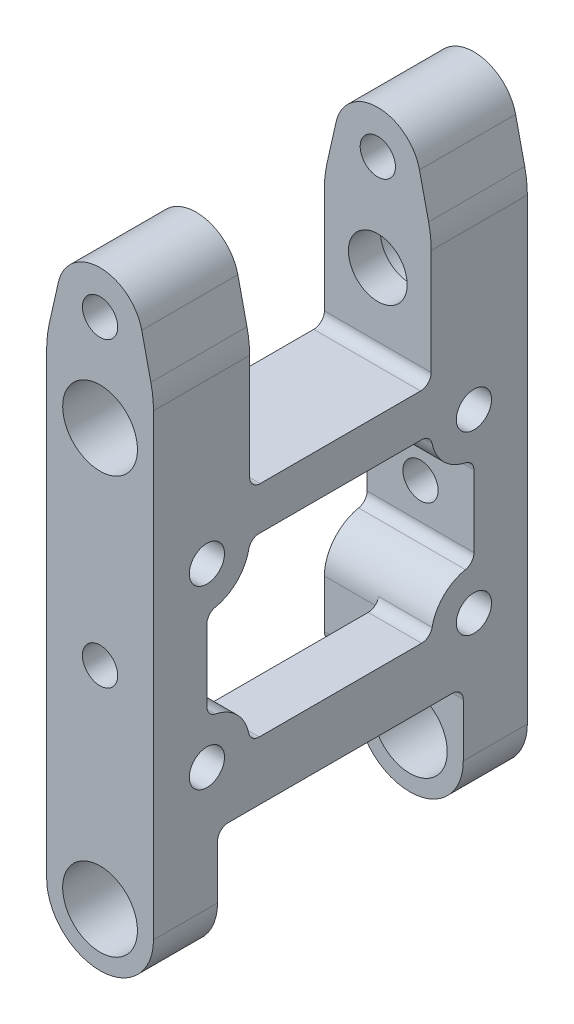
from build123d import *

# Parameters (mm, degrees)
SKETCH_2_R          = 2.750000000000002
SKETCH_2_R_2        = 2.7500000000000018
EXTRUDE_1_DEPTH     = 17.5
SKETCH_8_W          = 23
SKETCH_8_H          = 10.999999999999996
SKETCH_8_W_2        = 17
SKETCH_8_H_2        = 19.999999999999993
CUT_EXTRUDE_2_DEPTH = 56.76961538328914
SKETCH_3_R          = 3.5000000000000004
SKETCH_3_R_2        = 3.500000000000001
CUT_EXTRUDE_1_DEPTH = 6
HOLE_WIZARD_M4_1_D  = 3.3
CUT_EXTRUDE_3_DEPTH = 56.76961538328914
HOLE_WIZARD_M4_2_D  = 3.3
SKETCH_15_W         = 17
SKETCH_15_H         = 5.4999999999999325
CUT_EXTRUDE_5_DEPTH = 5
FILLET_1_R          = 1
FILLET_2_R          = 10


with BuildPart() as part:
    # 草图2 → 凸台-拉伸1 (new, symmetric)
    with BuildSketch(Plane.XY):
        with BuildLine():
            Line((-65, -6.94e-15), (-65, 44.000000000000014))
            Line((-65, 44.000000000000014), (-63.90243902439025, 48.878048780487816))
            ThreePointArc((-63.90243902439025, 48.878048780487816), (-59.99999999999999, 52.00000000000001), (-56.09756097560975, 48.87804878048781))
            Line((-56.09756097560975, 48.87804878048781), (-55.00000000000001, 44.000000000000014))
            Line((-55.00000000000001, 44.000000000000014), (-55.00000000000001, -6.33e-15))
            ThreePointArc((-55.00000000000001, -6.33e-15), (-60, -5.000000000000007), (-65, -6.94e-15))
        make_face()
        with Locations((-60, 38.999999999999986)):
            Circle(SKETCH_2_R, mode=Mode.SUBTRACT)
        with Locations((-60, -6.94e-15)):
            Circle(SKETCH_2_R_2, mode=Mode.SUBTRACT)
    extrude(amount=EXTRUDE_1_DEPTH, both=True)

    # 草图8 → 切除-拉伸2 (cut, through all)
    with BuildSketch(Plane(origin=(-55.00000000000001, 0, 0), x_dir=(0, 0, -1), z_dir=(1, 1.8e-16, 0))):
        with Locations((0, 0.5000000000000178)):
            Rectangle(SKETCH_8_W, SKETCH_8_H)
        with Locations((0, 42.000000000000014)):
            Rectangle(SKETCH_8_W_2, SKETCH_8_H_2)
    extrude(amount=-CUT_EXTRUDE_2_DEPTH, mode=Mode.SUBTRACT)

    # 草图3 → 切除-拉伸1 (cut)
    with BuildSketch(Plane.XY.offset(17.5)):
        with Locations((-60, -6.94e-15)):
            Circle(SKETCH_3_R)
        with Locations(Location((-60, 38.999999999999986, 0), (0, 0, 180))):
            Circle(SKETCH_3_R_2)
    cut_extrude_1 = extrude(amount=-CUT_EXTRUDE_1_DEPTH, mode=Mode.SUBTRACT)

    # M4 螺纹孔1 (through all)
    with Locations(Plane(origin=(-55.00000000000001, 0, 0), x_dir=(0, 0, -1), z_dir=(1, 1.8e-16, 0))):
        with Locations((-12.5, 11.5), (12.5, 11.5), (-12.5, 28), (12.5, 28)):
            Hole(HOLE_WIZARD_M4_1_D / 2)

    # 镜向1: 切除-拉伸1 across plane
    add(cut_extrude_1.mirror(Plane.XY), mode=Mode.SUBTRACT)

    # 草图11 → 切除-拉伸3 (cut, through all)
    with BuildSketch(Plane.ZY.offset(65)):
        with BuildLine():
            Line((-12.5, 23.99999999999997), (-12.5, 15.499999999999966))
            ThreePointArc((-12.5, 15.499999999999966), (-9.67157287525381, 14.328427124746156), (-8.5, 11.499999999999966))
            Line((-8.5, 11.499999999999966), (8.5, 11.499999999999966))
            ThreePointArc((8.5, 11.499999999999966), (9.67157287525381, 14.328427124746156), (12.5, 15.499999999999966))
            Line((12.5, 15.499999999999966), (12.5, 23.99999999999997))
            ThreePointArc((12.5, 23.99999999999997), (9.671572875253812, 25.171572875253784), (8.500000000000004, 27.99999999999997))
            Line((8.500000000000004, 27.99999999999997), (-8.500000000000004, 27.99999999999997))
            ThreePointArc((-8.500000000000004, 27.99999999999997), (-9.671572875253812, 25.171572875253784), (-12.5, 23.99999999999997))
        make_face()
    extrude(amount=-CUT_EXTRUDE_3_DEPTH, mode=Mode.SUBTRACT)

    # M4 螺纹孔2 (through all)
    with Locations(Plane.XY.offset(17.5)):
        with Locations((-60, 19.75), (-60, 48)):
            Hole(HOLE_WIZARD_M4_2_D / 2)

    # 草图15 → 切除-拉伸5 (cut)
    with BuildSketch(Plane.ZY.offset(65)):
        with Locations((0, 8.75)):
            Rectangle(SKETCH_15_W, SKETCH_15_H)
    extrude(amount=-CUT_EXTRUDE_5_DEPTH, mode=Mode.SUBTRACT)

    # 圆角1
    fillet_1_edges = [part.edges().sort_by_distance(p)[0] for p in [
        (-57.5, 11.499999999999968, -8.5),
        (-60, 15.499999999999966, -12.5),
        (-60, 23.99999999999997, -12.5),
        (-60, 27.99999999999997, -8.500000000000002),
        (-60, 27.99999999999997, 8.500000000000002),
        (-60, 23.99999999999997, 12.5),
        (-60, 15.499999999999966, 12.5),
        (-57.5, 11.499999999999968, 8.5),
        (-62.5, 6.000000000000034, -8.5),
        (-62.5, 6.000000000000034, 8.5),
        (-60, 6.000000000000015, -11.5),
        (-60, 6.000000000000015, 11.5),
        (-60.00000000000001, 32.000000000000014, 8.5),
        (-60.00000000000001, 32.000000000000014, -8.5),
    ]]
    fillet(fillet_1_edges, radius=FILLET_1_R)

    # 圆角2
    fillet_2_edges = [part.edges().sort_by_distance(p)[0] for p in [
        (-55.00000000000001, 44.000000000000014, 13),
        (-65, 44.000000000000014, 13),
        (-55.00000000000001, 44.000000000000014, -13),
        (-65, 44.000000000000014, -13),
    ]]
    fillet(fillet_2_edges, radius=FILLET_2_R)


solid = part.part
